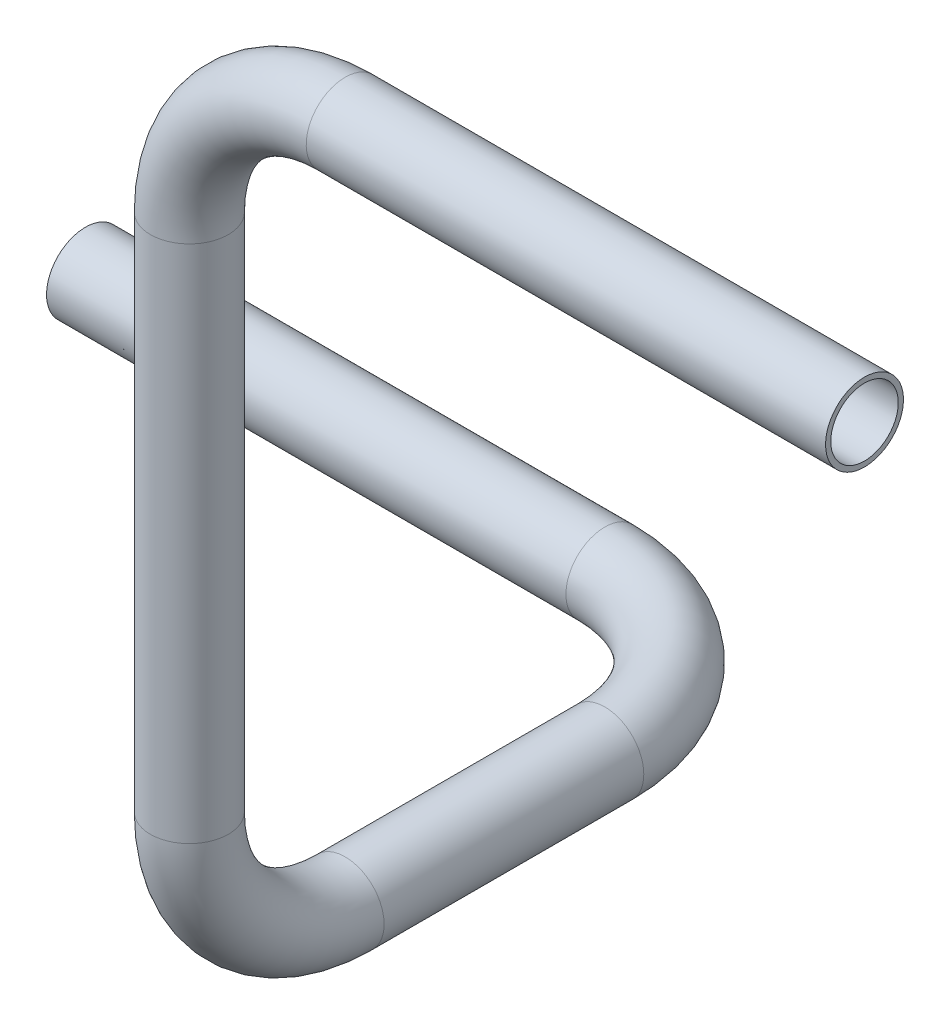
from build123d import *

# Parameters (mm, degrees)
SWEEP_THIN1_PROFILE_R   = 15
SWEEP_THIN1_PROFILE_R_2 = 13


with BuildPart() as part:
    # Sweep-Thin1: sweep along a curve in space
    with BuildLine() as sweep_thin1_path:
        Line((0, 0, 0), (200, 0, 0))
        ThreePointArc((260, 0, 60), (242.426406871, 0, 17.573593129), (200, 0, 0))
        Line((260, 0, 60), (260, 0, 160))
        ThreePointArc((260, 60, 220), (260, 17.573593129, 202.426406871), (260, 0, 160))
        Line((260, 60, 220), (260, 260, 220))
        ThreePointArc((320, 320, 220), (277.573593129, 302.426406871, 220), (260, 260, 220))
        Line((320, 320, 220), (520, 320, 220))
    # Sweep-Thin1 profile (on start of the path) → Sweep-Thin1 (sweep)
    with BuildSketch(Plane(origin=(0, 0, 0), x_dir=(0, 0, 1), z_dir=(1, 0, 0))):
        Circle(SWEEP_THIN1_PROFILE_R)
        Circle(SWEEP_THIN1_PROFILE_R_2, mode=Mode.SUBTRACT)
    sweep(path=sweep_thin1_path.line)


solid = part.part
